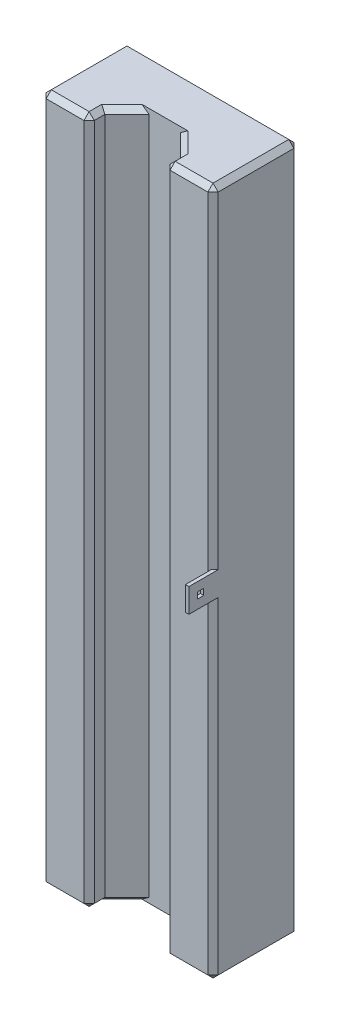
from build123d import *

# Parameters (mm, degrees)
SKETCH1_W                = 50
SKETCH1_H                = 200
BOSS_EXTRUDE1_DEPTH      = 25
CUT_EXTRUDE1_DEPTH       = 208.665596573
CHAMFER1_SIZE            = 1.5
BOSS_EXTRUDE2_DEPTH      = 7
BOSS_EXTRUDE2_DEPTH_BACK = 10
SKETCH3_W                = 1
SKETCH3_H                = 7
SKETCH4_W                = 1.8
SKETCH4_H                = 1.8
CUT_EXTRUDE2_DEPTH       = 7


with BuildPart() as part:
    # Sketch1 → Boss-Extrude1 (new body)
    with BuildSketch(Plane.XY):
        with Locations((25, 100)):
            Rectangle(SKETCH1_W, SKETCH1_H)
    extrude(amount=BOSS_EXTRUDE1_DEPTH)

    # Sketch2 → Cut-Extrude1 (cut, through all)
    with BuildSketch(Plane.XZ):
        Polygon((29.556349186, 36), (20.443650814, 36), (14, 29.556349186), (14, 20.443650814), (20.443650814, 14), (29.556349186, 14), (36, 20.443650814), (36, 29.556349186), align=None)
    extrude(amount=-CUT_EXTRUDE1_DEPTH, mode=Mode.SUBTRACT)

    # Chamfer1
    chamfer1_edges = [part.edges().sort_by_distance(p)[0] for p in [
        (50, 100, 25),
        (43, 200, 25),
        (43, 0, 25),
        (7, 200, 25),
        (14, 100, 25),
        (36, 100, 25),
        (36, 200, 22.721825407),
        (14, 200, 22.721825407),
        (36, 0, 22.721825407),
        (14, 0, 22.721825407),
        (17.221825407, 0, 17.221825407),
        (32.778174593, 0, 17.221825407),
        (32.778174593, 200, 17.221825407),
        (17.221825407, 200, 17.221825407),
        (0, 100, 25),
        (25, 200, 0),
        (50, 100, 0),
        (25, 0, 0),
        (0, 100, 0),
        (7, 0, 25),
        (0, 200, 12.5),
        (50, 200, 12.5),
        (50, 0, 12.5),
        (0, 0, 12.5),
    ]]
    chamfer(chamfer1_edges, length=CHAMFER1_SIZE)

    # Sketch3 → Boss-Extrude2 (add, two sides: drawn at the far end of the back side and taken through both)
    with BuildSketch(Plane.XY.offset(25).offset(-BOSS_EXTRUDE2_DEPTH_BACK)):
        with Locations((49.5, 100)):
            Rectangle(SKETCH3_W, SKETCH3_H)
    extrude(amount=BOSS_EXTRUDE2_DEPTH + BOSS_EXTRUDE2_DEPTH_BACK)

    # Sketch4 → Cut-Extrude2 (cut)
    with BuildSketch(Plane(origin=(50, 0, 0), x_dir=(0, 0, -1), z_dir=(1, 0, 0))):
        with Locations((-28.6, 100)):
            Rectangle(SKETCH4_W, SKETCH4_H)
    extrude(amount=-CUT_EXTRUDE2_DEPTH, mode=Mode.SUBTRACT)


solid = part.part
